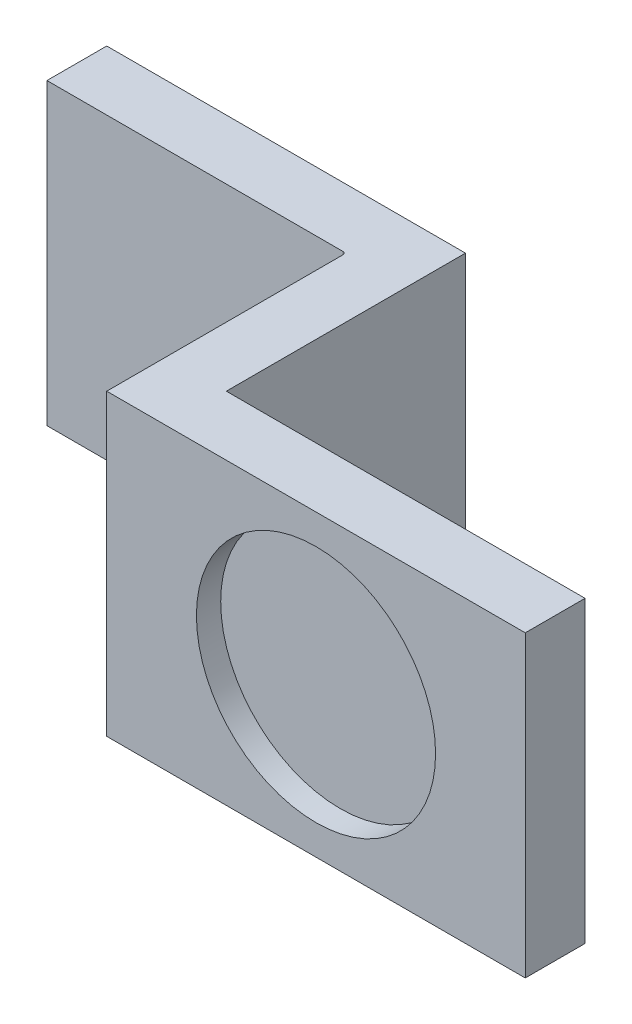
from build123d import *

# Parameters (mm, degrees)
ESQUISSE1_W             = 30
ESQUISSE1_H             = 25
BOSS_EXTRU_2_DEPTH      = 5
ESQUISSE2_W             = 20
ESQUISSE2_H             = 25
BOSS_EXTRU_4_DEPTH      = 5
ESQUISSE3_W             = 5
ESQUISSE3_H             = 25
BOSS_EXTRU_5_DEPTH      = 30
CONG_1_R                = 0.25
ESQUISSE4_R             = 10
ENL_V_MAT_EXTRU_1_DEPTH = 2.03


with BuildPart() as part:
    # Esquisse1 → Boss.-Extru.2 (new body)
    with BuildSketch(Plane.XY):
        Rectangle(ESQUISSE1_W, ESQUISSE1_H)
    extrude(amount=BOSS_EXTRU_2_DEPTH)

    # Esquisse2 → Boss.-Extru.4 (add)
    with BuildSketch(Plane(origin=(15, 0, 0), x_dir=(0, 0, -1), z_dir=(1, 0, 0))):
        with Locations((-15, 0)):
            Rectangle(ESQUISSE2_W, ESQUISSE2_H)
    extrude(amount=-BOSS_EXTRU_4_DEPTH)

    # Esquisse3 → Boss.-Extru.5 (add)
    with BuildSketch(Plane(origin=(15, 0, 0), x_dir=(0, 0, -1), z_dir=(1, 0, 0))):
        with Locations((-22.5, 0)):
            Rectangle(ESQUISSE3_W, ESQUISSE3_H)
    extrude(amount=BOSS_EXTRU_5_DEPTH)

    # Congé1
    cong_1_edges = [part.edges().sort_by_distance(p)[0] for p in [
        (10, 0, 5),
    ]]
    fillet(cong_1_edges, radius=CONG_1_R)

    # Esquisse4 → Enlèv. mat.-Extru.1 (cut)
    with BuildSketch(Plane.XY.offset(25)):
        with Locations((27.5, 0)):
            Circle(ESQUISSE4_R)
    extrude(amount=-ENL_V_MAT_EXTRU_1_DEPTH, mode=Mode.SUBTRACT)


solid = part.part
